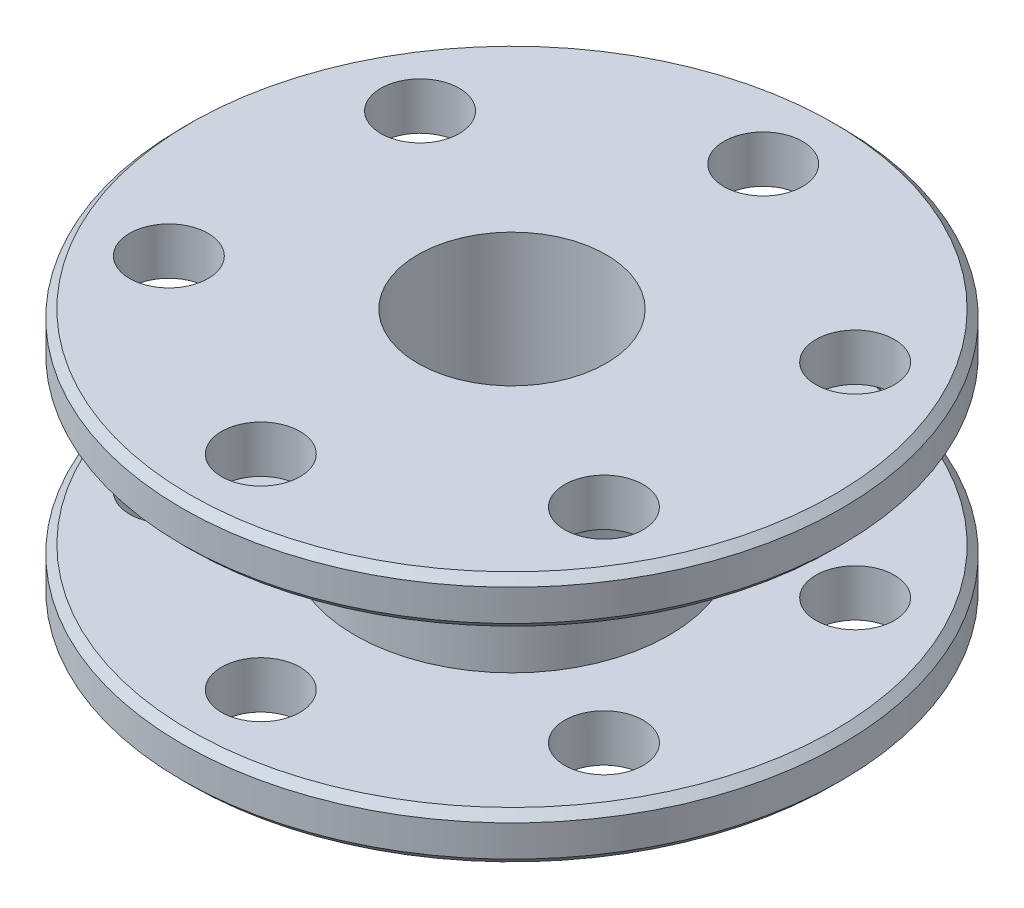
from build123d import *

# Parameters (mm, degrees)
SKETCH1_R           = 21
SKETCH1_R_2         = 6
SKETCH1_R_3         = 2.5
BOSS_EXTRUDE1_DEPTH = 16
SKETCH2_W           = 17.337726117
SKETCH2_H           = 10
CHAMFER1_SIZE       = 0.5


with BuildPart() as part:
    # Sketch1 → Boss-Extrude1 (new body)
    with BuildSketch(Plane(origin=(0, 0, 0), x_dir=(1, 0, 0), z_dir=(0, 1, 0))):
        with Locations(Location((0, 0, 0), (0, 0, 270))):
            Circle(SKETCH1_R)
        with Locations(Location((0, 0, 0), (0, 0, 270))):
            Circle(SKETCH1_R_2, mode=Mode.SUBTRACT)
        with Locations(Location((0, 16, 0), (0, 0, 270))):
            Circle(SKETCH1_R_3, mode=Mode.SUBTRACT)
        with Locations(Location((13.856406461, 8, 0), (0, 0, 270))):
            Circle(SKETCH1_R_3, mode=Mode.SUBTRACT)
        with Locations(Location((13.856406461, -8, 0), (0, 0, 270))):
            Circle(SKETCH1_R_3, mode=Mode.SUBTRACT)
        with Locations(Location((0, -16, 0), (0, 0, 270))):
            Circle(SKETCH1_R_3, mode=Mode.SUBTRACT)
        with Locations(Location((-13.856406461, -8, 0), (0, 0, 270))):
            Circle(SKETCH1_R_3, mode=Mode.SUBTRACT)
        with Locations(Location((-13.856406461, 8, 0), (0, 0, 270))):
            Circle(SKETCH1_R_3, mode=Mode.SUBTRACT)
    extrude(amount=BOSS_EXTRUDE1_DEPTH)

    # Sketch2 → Cut-Revolve1 (revolve, cut)
    with BuildSketch(Plane(origin=(0, 0, 0), x_dir=(0, 0, -1), z_dir=(1, 0, 0))):
        with Locations((18.668863059, 8)):
            Rectangle(SKETCH2_W, SKETCH2_H)
    revolve(axis=Axis((0, 0, 0), (0, 1, 0)), mode=Mode.SUBTRACT)

    # Chamfer1
    chamfer1_edges = [part.edges().sort_by_distance(p)[0] for p in [
        (0, 0, -21),
        (0, 3, -21),
        (0, 13, -21),
        (0, 16, -21),
    ]]
    chamfer(chamfer1_edges, length=CHAMFER1_SIZE)


solid = part.part
